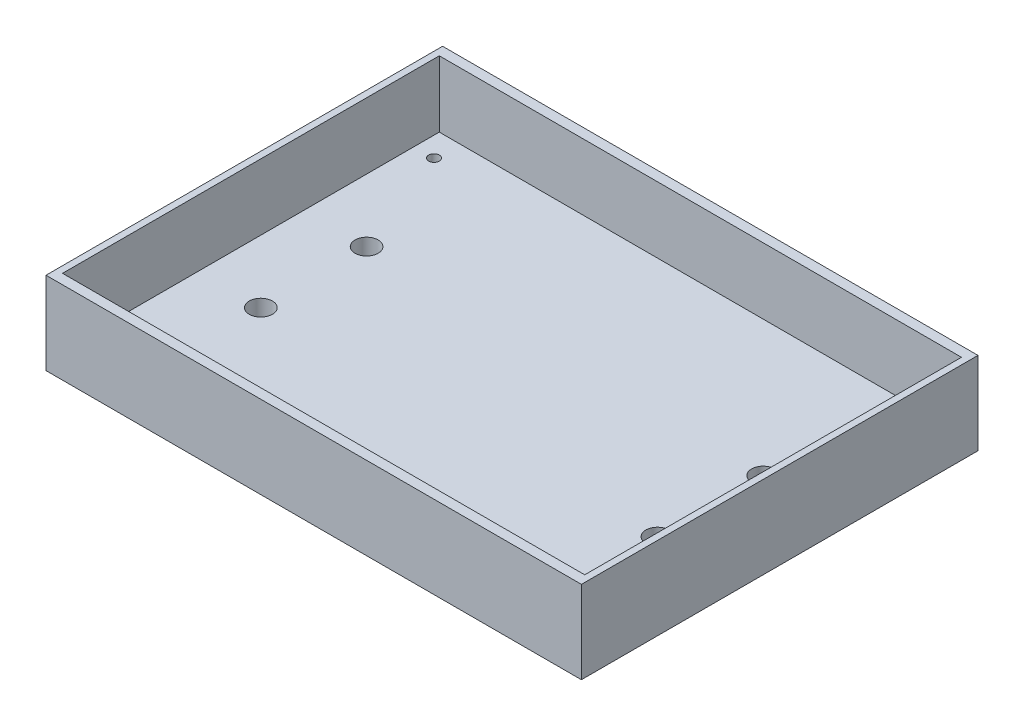
from build123d import *

# Parameters (mm, degrees)
SKETCH1_W           = 102.87
SKETCH1_H           = 76.2
SKETCH1_R           = 2.2225
SKETCH1_R_2         = 1.016
BOSS_EXTRUDE1_DEPTH = 3.175
SKETCH2_W           = 102.87
SKETCH2_H           = 76.2
SKETCH2_W_2         = 100.33
SKETCH2_H_2         = 72.39
BOSS_EXTRUDE3_DEPTH = 12.7


with BuildPart() as part:
    # Sketch1 → Boss-Extrude1 (new body)
    with BuildSketch(Plane(origin=(0, 0, 0), x_dir=(1, 0, 0), z_dir=(0, 1, 0))):
        Rectangle(SKETCH1_W, SKETCH1_H)
        with Locations((-38.1, -10.16)):
            Circle(SKETCH1_R, mode=Mode.SUBTRACT)
        with Locations((38.1, -10.16)):
            Circle(SKETCH1_R, mode=Mode.SUBTRACT)
        with Locations((-38.1, 10.16)):
            Circle(SKETCH1_R, mode=Mode.SUBTRACT)
        with Locations((38.1, 10.16)):
            Circle(SKETCH1_R, mode=Mode.SUBTRACT)
        with Locations((-46.355, 31.369)):
            Circle(SKETCH1_R_2, mode=Mode.SUBTRACT)
        with Locations((-46.355, -31.369)):
            Circle(SKETCH1_R_2, mode=Mode.SUBTRACT)
        with Locations((46.355, 31.369)):
            Circle(SKETCH1_R_2, mode=Mode.SUBTRACT)
        with Locations((46.355, -31.369)):
            Circle(SKETCH1_R_2, mode=Mode.SUBTRACT)
    extrude(amount=BOSS_EXTRUDE1_DEPTH)

    # Sketch2 → Boss-Extrude3 (add)
    with BuildSketch(Plane(origin=(0, 3.175, 0), x_dir=(1, 0, 0), z_dir=(0, 1, 0))):
        Rectangle(SKETCH2_W, SKETCH2_H)
        Rectangle(SKETCH2_W_2, SKETCH2_H_2, mode=Mode.SUBTRACT)
    extrude(amount=BOSS_EXTRUDE3_DEPTH)


solid = part.part
